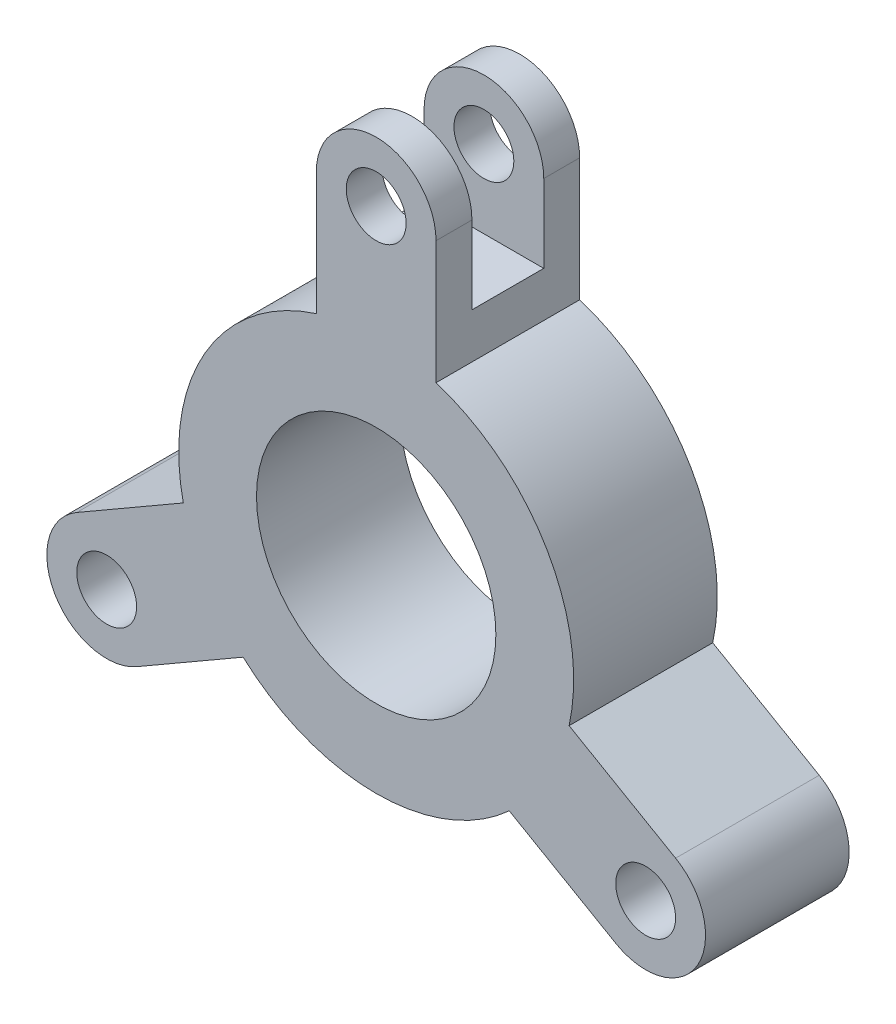
from build123d import *

# Parameters (mm, degrees)
EXTRUDE_1_DEPTH          = 6
EXTRUDE_1_DEPTH_BACK     = 6
SKETCH_1_R               = 10
SKETCH_1_R_2             = 2.5
CUT_EXTRUDE_1_DEPTH      = 3
CUT_EXTRUDE_1_DEPTH_BACK = 3
SKETCH_2_W               = 15
SKETCH_2_H               = 13


with BuildPart() as part:
    # Эскиз1 → Бобышка-Вытянуть1 (new, two sides: drawn at the far end of the back side and taken through both)
    with BuildSketch(Plane.XY.offset(-EXTRUDE_1_DEPTH_BACK)):
        with BuildLine():
            ThreePointArc((-5, 15.724185194), (-14.289419162, 8.25), (-16.117543831, -3.531965578))
            Line((-16.117543831, -3.531965578), (-25.016660498, -8.669872981))
            ThreePointArc((-25.016660498, -8.669872981), (-26.846787517, -15.5), (-20.016660498, -17.330127019))
            Line((-20.016660498, -17.330127019), (-11.117543831, -12.192219616))
            ThreePointArc((-11.117543831, -12.192219616), (0, -16.5), (11.117543831, -12.192219616))
            Line((11.117543831, -12.192219616), (20.016660498, -17.330127019))
            ThreePointArc((20.016660498, -17.330127019), (26.846787517, -15.5), (25.016660498, -8.669872981))
            Line((25.016660498, -8.669872981), (16.117543831, -3.531965578))
            ThreePointArc((16.117543831, -3.531965578), (14.289419162, 8.25), (5, 15.724185194))
            Line((5, 15.724185194), (5, 26))
            ThreePointArc((5, 26), (0, 31), (-5, 26))
            Line((-5, 26), (-5, 15.724185194))
        make_face()
        Circle(SKETCH_1_R, mode=Mode.SUBTRACT)
        with Locations((-22.516660498, -13)):
            Circle(SKETCH_1_R_2, mode=Mode.SUBTRACT)
        with Locations((0, 26)):
            Circle(SKETCH_1_R_2, mode=Mode.SUBTRACT)
        with Locations((22.516660498, -13)):
            Circle(SKETCH_1_R_2, mode=Mode.SUBTRACT)
    extrude(amount=EXTRUDE_1_DEPTH + EXTRUDE_1_DEPTH_BACK)

    # Эскиз2 → Вырез-Вытянуть1 (cut, two sides: drawn at the far end of the back side and taken through both)
    with BuildSketch(Plane.XY.offset(-CUT_EXTRUDE_1_DEPTH_BACK)):
        with Locations((0, 26)):
            Rectangle(SKETCH_2_W, SKETCH_2_H)
    extrude(amount=CUT_EXTRUDE_1_DEPTH + CUT_EXTRUDE_1_DEPTH_BACK, mode=Mode.SUBTRACT)


solid = part.part
